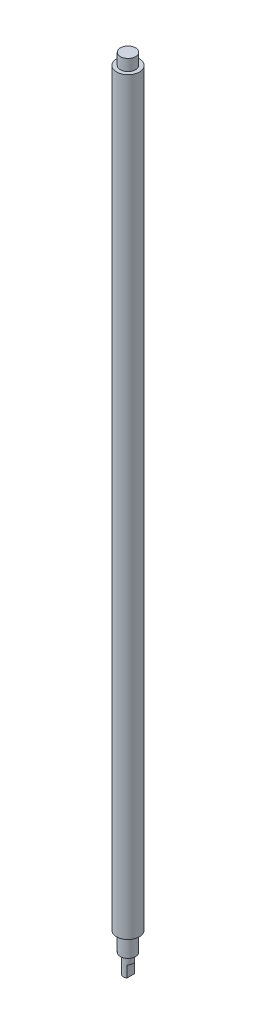
from build123d import *

# Parameters (mm, degrees)
SKETCH1_R           = 4
BOSS_EXTRUDE1_DEPTH = 420
SKETCH1_3_R         = 6
SKETCH1_3_R_2       = 4
BOSS_EXTRUDE2_DEPTH = 414
SKETCH1_4_R         = 6
SKETCH1_4_R_2       = 4
CUT_EXTRUDE1_DEPTH  = 20
SKETCH1_5_R         = 4
CUT_EXTRUDE2_DEPTH  = 10
CUT_EXTRUDE3_DEPTH  = 6


with BuildPart() as part:
    # Sketch1 → Boss-Extrude1 (new body)
    with BuildSketch(Plane(origin=(0, 0, 0), x_dir=(1, 0, 0), z_dir=(0, 1, 0))):
        Circle(SKETCH1_R)
    extrude(amount=BOSS_EXTRUDE1_DEPTH)

    # Sketch1<3> → Boss-Extrude2 (add)
    with BuildSketch(Plane(origin=(0, 0, 0), x_dir=(1, 0, 0), z_dir=(0, 1, 0))):
        Circle(SKETCH1_3_R)
        Circle(SKETCH1_3_R_2, mode=Mode.SUBTRACT)
    extrude(amount=BOSS_EXTRUDE2_DEPTH)

    # Sketch1<4> → Cut-Extrude1 (cut)
    with BuildSketch(Plane(origin=(0, 0, 0), x_dir=(1, 0, 0), z_dir=(0, 1, 0))):
        Circle(SKETCH1_4_R)
        Circle(SKETCH1_4_R_2, mode=Mode.SUBTRACT)
    extrude(amount=CUT_EXTRUDE1_DEPTH, mode=Mode.SUBTRACT)

    # Sketch1<5> → Cut-Extrude2 (cut)
    with BuildSketch(Plane(origin=(0, 0, 0), x_dir=(1, 0, 0), z_dir=(0, 1, 0))):
        Circle(SKETCH1_5_R)
        with BuildLine():
            ThreePointArc((1.5, -2), (-2.5, 0), (1.5, 2))
            ThreePointArc((1.5, 2), (2.236067977, 1.118033989), (2.5, 0))
            ThreePointArc((2.5, 0), (2.236067977, -1.118033989), (1.5, -2))
        make_face(mode=Mode.SUBTRACT)
    extrude(amount=CUT_EXTRUDE2_DEPTH, mode=Mode.SUBTRACT)

    # Sketch1<6> → Cut-Extrude3 (cut)
    with BuildSketch(Plane(origin=(0, 0, 0), x_dir=(1, 0, 0), z_dir=(0, 1, 0))):
        with BuildLine():
            ThreePointArc((2.5, 0), (2.236067977, 1.118033989), (1.5, 2))
            Line((1.5, 2), (1.5, -2))
            ThreePointArc((1.5, -2), (2.236067977, -1.118033989), (2.5, 0))
        make_face()
    extrude(amount=CUT_EXTRUDE3_DEPTH, mode=Mode.SUBTRACT)


solid = part.part
